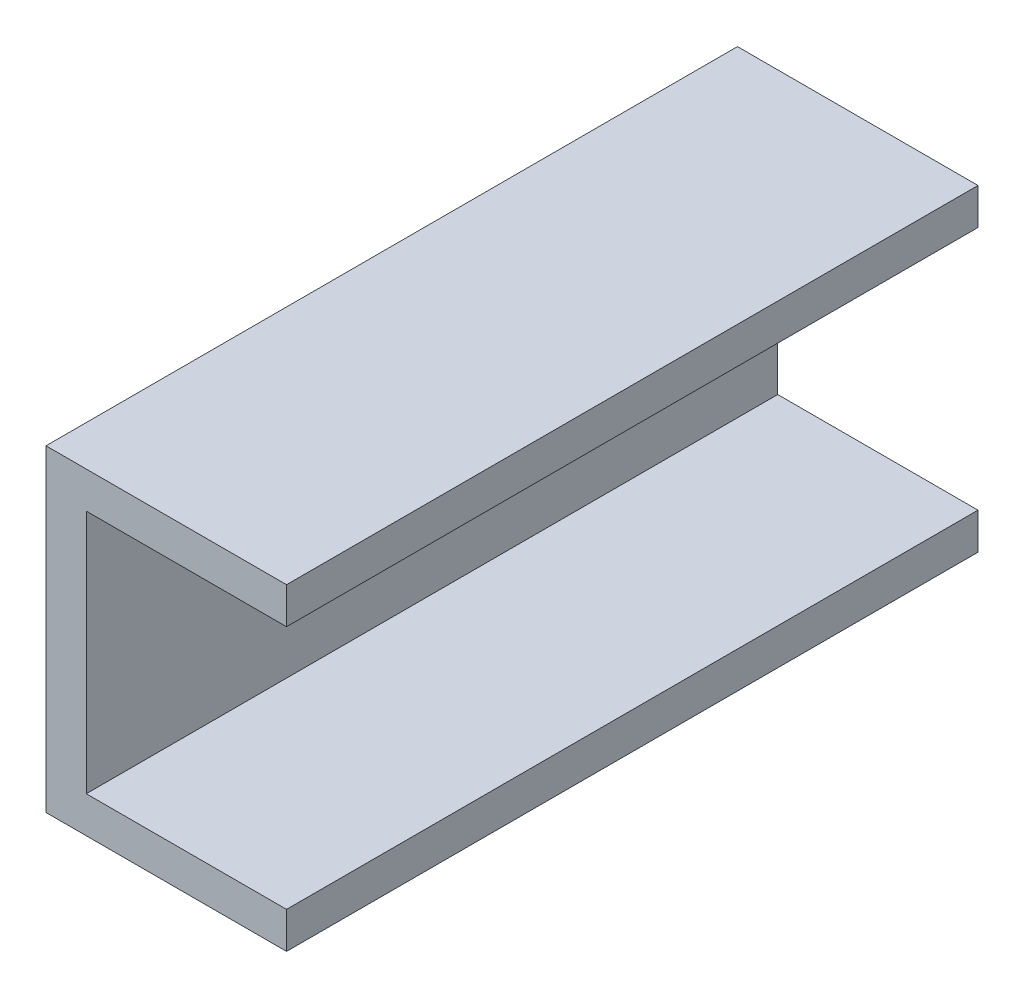
from build123d import *

# Parameters (mm, degrees)
BOSS_EXTRUDE1_DEPTH = 152.4


with BuildPart() as part:
    # Sketch1 → Boss-Extrude1 (new body)
    with BuildSketch(Plane.XY):
        Polygon((0, 35), (0, -35), (53.017157285, -35), (53.017157285, -26.974522293), (8.877029896, -26.974522293), (8.877029896, 26.974522293), (53.017157285, 26.974522293), (53.017157285, 35), align=None)
    extrude(amount=BOSS_EXTRUDE1_DEPTH)


solid = part.part
